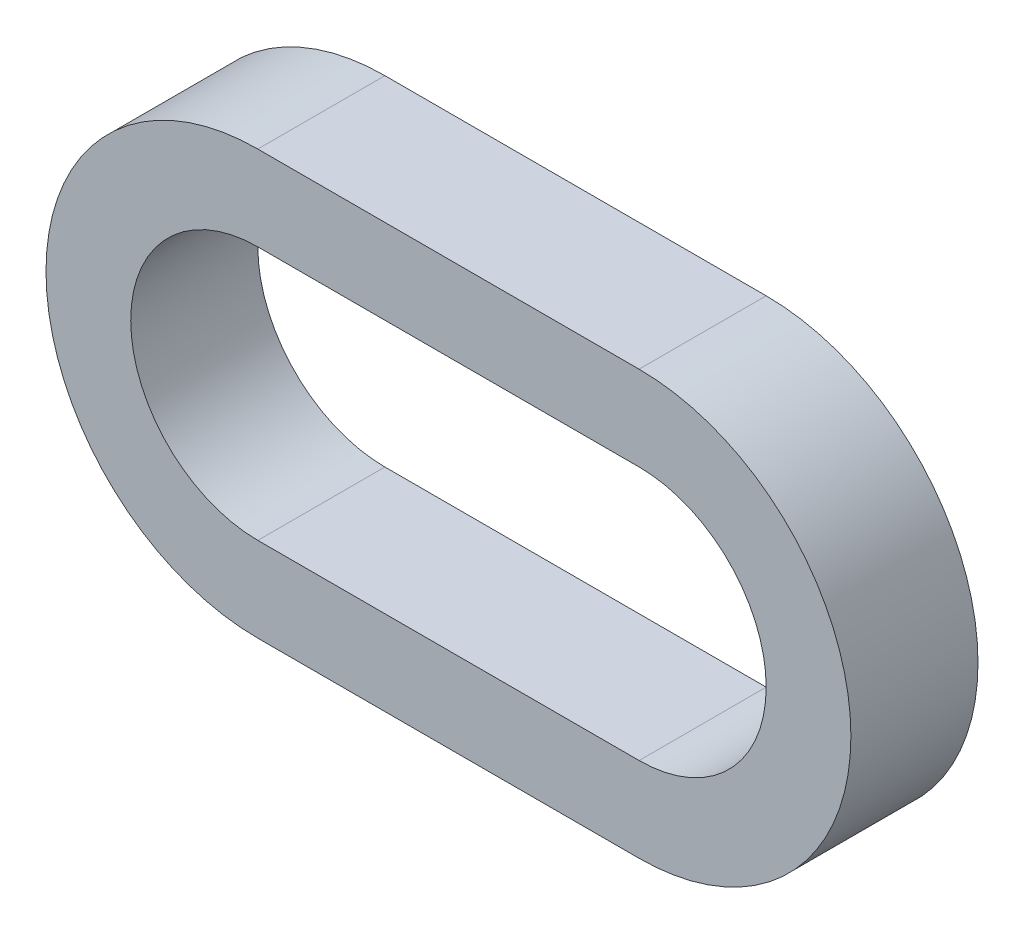
from build123d import *

# Parameters (mm, degrees)
BOSS_EXTRUDE1_DEPTH = 60


with BuildPart() as part:
    # Sketch2 → Boss-Extrude1 (new body)
    with BuildSketch(Plane.XY):
        with BuildLine():
            Line((-90, 100), (90, 100))
            ThreePointArc((90, 100), (190, 0), (90, -100))
            Line((90, -100), (-90, -100))
            ThreePointArc((-90, -100), (-190, 0), (-90, 100))
        make_face()
        with BuildLine():
            Line((-90, 60), (90, 60))
            ThreePointArc((90, 60), (150, 0), (90, -60))
            Line((90, -60), (-90, -60))
            ThreePointArc((-90, -60), (-150, 0), (-90, 60))
        make_face(mode=Mode.SUBTRACT)
    extrude(amount=BOSS_EXTRUDE1_DEPTH)


solid = part.part
